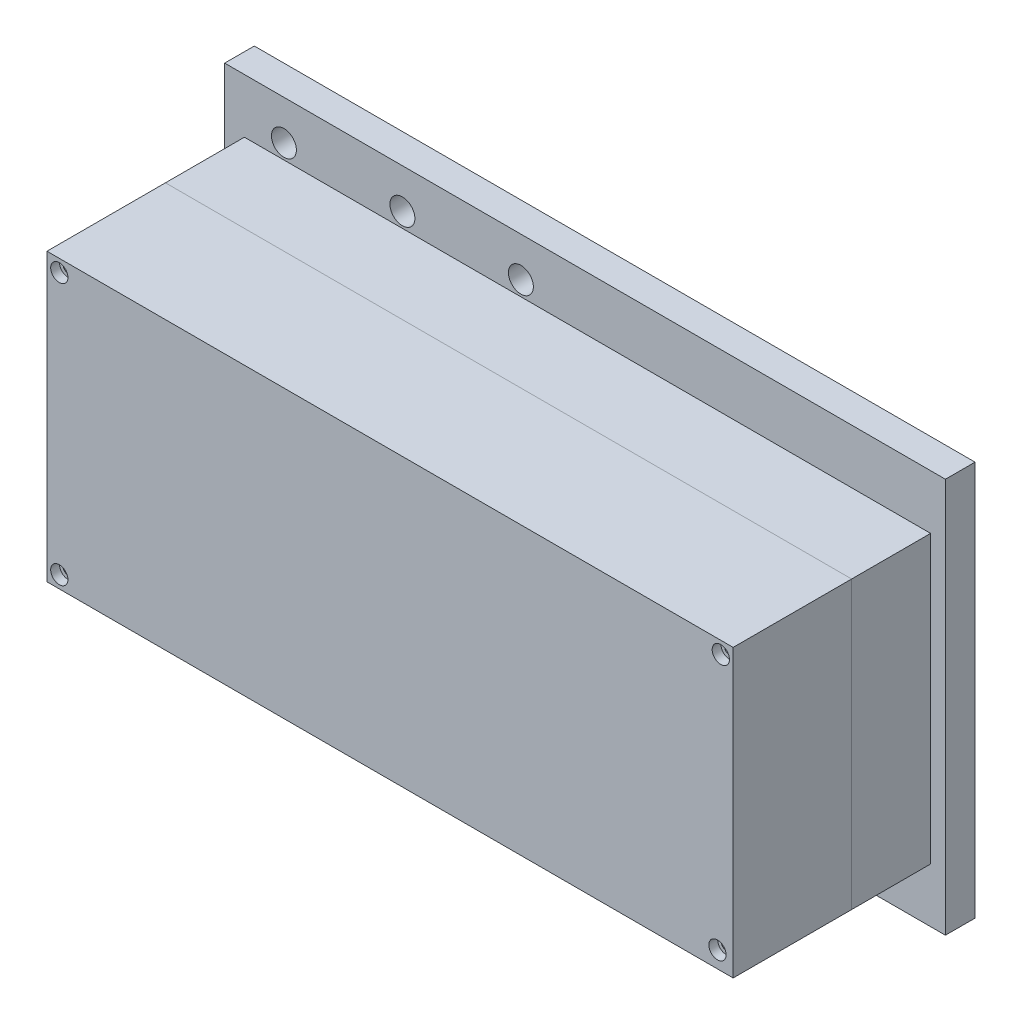
from build123d import *

# Parameters (mm, degrees)
SKETCH1_W                                     = 231.775
SKETCH1_H                                     = 127
BASE_DEPTH                                    = 9.525
O_0_316_DIAMETER_HOLE1_D                      = 8.0264
SKETCH4_W                                     = 220.6625
SKETCH4_H                                     = 92.075
SKETCH4_W_2                                   = 204.7875
SKETCH4_H_2                                   = 76.2
BOSS_EXTRUDE2_DEPTH                           = 25.4
F_23_0_154_DIAMETER_HOLE1_D                   = 3.9116
F_23_0_154_DIAMETER_HOLE1_CSINK_D             = 5.1816
F_23_0_154_DIAMETER_HOLE1_CSINK_ANGLE         = 90
F_23_0_154_DIAMETER_HOLE2_D                   = 3.9116
F_23_0_154_DIAMETER_HOLE2_DEPTH               = 12.7
F_23_0_154_DIAMETER_HOLE2_CSINK_D             = 5.1816
F_23_0_154_DIAMETER_HOLE2_CSINK_ANGLE         = 90
F_23_0_154_DIAMETER_HOLE2_TIP                 = 1.175163199
CUT_EXTRUDE1_REACH                            = 165.243
SKETCH11_W                                    = 192.0875
SKETCH11_H                                    = 12.7
CUT_EXTRUDE2_REACH                            = 238.788
SKETCH12_W                                    = 12.7
SKETCH12_H                                    = 63.5
BOSS_EXTRUDE3_DEPTH                           = 31.75
BOSS_EXTRUDE3_2_DEPTH                         = 31.75
SKETCH14_W                                    = 220.6625
SKETCH14_H                                    = 92.075
BOSS_EXTRUDE4_DEPTH                           = 6.35
CBORE_FOR_4_SOCKET_HEAD_CAP_SCREW1_AT_2_COUNT = 2
CBORE_FOR_4_SOCKET_HEAD_CAP_SCREW1_AT_2_PITCH = 84.1375
CBORE_FOR_4_SOCKET_HEAD_CAP_SCREW1_AT_3_COUNT = 2
CBORE_FOR_4_SOCKET_HEAD_CAP_SCREW1_AT_3_PITCH = 228.75979658
CBORE_FOR_4_SOCKET_HEAD_CAP_SCREW1_AT_4_COUNT = 2
CBORE_FOR_4_SOCKET_HEAD_CAP_SCREW1_AT_4_PITCH = 211.660894197
FILLET1_R                                     = 2.54


with BuildPart() as part:
    # Sketch1 → base (new body)
    with BuildSketch(Plane.XY):
        Rectangle(SKETCH1_W, SKETCH1_H)
    extrude(amount=BASE_DEPTH)

    # O (0.316) Diameter Hole1 (through all)
    with Locations(Plane.XY.offset(9.525)):
        with Locations((-96.8375, 50.8), (-58.7375, 50.8), (-20.6375, 50.8), (-20.6375, 25.4), (-58.7375, 25.4), (-96.8375, 25.4), (-96.8375, -25.4), (-96.8375, -50.8), (-58.7375, -50.8), (-58.7375, -25.4), (-20.6375, -25.4), (-20.6375, -50.8)):
            Hole(O_0_316_DIAMETER_HOLE1_D / 2)

    # Sketch4 → Boss-Extrude2 (add)
    with BuildSketch(Plane.XY.offset(9.525)):
        with Locations((0.79375, 0)):
            Rectangle(SKETCH4_W, SKETCH4_H)
        with Locations((0.79375, 0)):
            Rectangle(SKETCH4_W_2, SKETCH4_H_2, mode=Mode.SUBTRACT)
    extrude(amount=BOSS_EXTRUDE2_DEPTH)

    # #23 (0.154) Diameter Hole1 (through all)
    with Locations(Plane.XY.offset(9.525)):
        with Locations((74.83475, 22.733), (74.83475, -22.733), (-85.94725, 21.717), (49.43475, 21.717), (49.43475, -21.717), (-85.94725, -21.717)):
            CounterSinkHole(F_23_0_154_DIAMETER_HOLE1_D / 2, F_23_0_154_DIAMETER_HOLE1_CSINK_D / 2, counter_sink_angle=F_23_0_154_DIAMETER_HOLE1_CSINK_ANGLE)

    # #23 (0.154) Diameter Hole2
    with Locations(Plane.XY.offset(34.925)):
        with Locations((-105.56875, 42.06875), (-105.56875, -42.06875), (106.087893927, -40.727402306), (107.15625, 42.06875)):
            CounterSinkHole(F_23_0_154_DIAMETER_HOLE2_D / 2, F_23_0_154_DIAMETER_HOLE2_CSINK_D / 2, depth=F_23_0_154_DIAMETER_HOLE2_DEPTH, counter_sink_angle=F_23_0_154_DIAMETER_HOLE2_CSINK_ANGLE)
            with Locations((0, 0, -(F_23_0_154_DIAMETER_HOLE2_DEPTH + F_23_0_154_DIAMETER_HOLE2_TIP / 2))):  # 118° drill point
                Cone(0, F_23_0_154_DIAMETER_HOLE2_D / 2, F_23_0_154_DIAMETER_HOLE2_TIP, mode=Mode.SUBTRACT)

    # Sketch11 → Cut-Extrude1 (cut, up to next)
    with BuildSketch(Plane.XZ.offset(46.0375), mode=Mode.PRIVATE) as cut_extrude1_sk1:
        with Locations((0.79375, 28.575)):
            Rectangle(SKETCH11_W, SKETCH11_H)
    cut_extrude1_tool1 = extrude(cut_extrude1_sk1.sketch, amount=-CUT_EXTRUDE1_REACH, mode=Mode.PRIVATE) & part.part
    add(cut_extrude1_tool1.solids().sort_by_distance((0.79375, -46.0375, 28.575))[0], mode=Mode.SUBTRACT)

    # Sketch12 → Cut-Extrude2 (cut, up to next)
    with BuildSketch(Plane.ZY.offset(109.5375), mode=Mode.PRIVATE) as cut_extrude2_sk1:
        with Locations((28.575, 0)):
            Rectangle(SKETCH12_W, SKETCH12_H)
    cut_extrude2_tool1 = extrude(cut_extrude2_sk1.sketch, amount=-CUT_EXTRUDE2_REACH, mode=Mode.PRIVATE) & part.part
    add(cut_extrude2_tool1.solids().sort_by_distance((-109.5375, 0, 28.575))[0], mode=Mode.SUBTRACT)


with BuildPart() as body_2:
    # Sketch13 → Boss-Extrude3 (new body)
    with BuildSketch(Plane.XY.offset(66.675)):
        Polygon((-101.6, 31.75), (-109.5375, 31.75), (-109.5375, 46.0375), (111.125, 46.0375), (111.125, -46.0375), (96.8375, -46.0375), (96.8375, -38.1), (103.1875, -38.1), (103.1875, 38.1), (-101.6, 38.1), align=None)
    extrude(amount=-BOSS_EXTRUDE3_DEPTH)



with BuildPart() as body_3:
    # Sketch13 → Boss-Extrude3 2 (new body)
    with BuildSketch(Plane.XY.offset(66.675)):
        Polygon((-101.6, -31.75), (-109.5375, -31.75), (-109.5375, -46.0375), (-95.25, -46.0375), (-95.25, -38.1), (-101.6, -38.1), align=None)
    extrude(amount=-BOSS_EXTRUDE3_2_DEPTH)


with BuildPart() as body_2_1:
    add(body_2.part)

    add(body_3.part)  # Boss-Extrude4 merges body 3
    # Sketch14 → Boss-Extrude4 (add)
    with BuildSketch(Plane.XY.offset(66.675)):
        with Locations((0.79375, 0)):
            Rectangle(SKETCH14_W, SKETCH14_H)
    extrude(amount=BOSS_EXTRUDE4_DEPTH)

    # Sketch16 → CBORE for #4 Socket Head Cap Screw1 (revolve, cut)
    with BuildSketch(Plane(origin=(-105.56875, -42.06875, 73.025), x_dir=(0, -1, 0), z_dir=(1, 0, 0))):
        Polygon((0, 0), (0, 73.025), (1.63195, 73.025), (1.63195, 2.8448), (2.77876, 2.8448), (2.77876, 0), align=None)
    cbore_for_4_socket_head_cap_screw1 = revolve(axis=Axis((-105.56875, -42.06875, 79.375), (0, 0, -1)), mode=Mode.SUBTRACT)

    # CBORE for #4 Socket Head Cap Screw1 at 2: CBORE for #4 Socket Head Cap Screw1 ×2
    with Locations(*[(0, i * CBORE_FOR_4_SOCKET_HEAD_CAP_SCREW1_AT_2_PITCH, 0) for i in range(1, CBORE_FOR_4_SOCKET_HEAD_CAP_SCREW1_AT_2_COUNT)]):
        add(cbore_for_4_socket_head_cap_screw1, mode=Mode.SUBTRACT)

    # CBORE for #4 Socket Head Cap Screw1 at 3: CBORE for #4 Socket Head Cap Screw1 ×2
    with Locations(*[Vector(0.9299055305190211, 0.36779845610080775, 0) * (i * CBORE_FOR_4_SOCKET_HEAD_CAP_SCREW1_AT_3_PITCH) for i in range(1, CBORE_FOR_4_SOCKET_HEAD_CAP_SCREW1_AT_3_COUNT)]):
        add(cbore_for_4_socket_head_cap_screw1, mode=Mode.SUBTRACT)

    # CBORE for #4 Socket Head Cap Screw1 at 4: CBORE for #4 Socket Head Cap Screw1 ×2
    with Locations(*[Vector(0.9999799194388271, 0.006337248544668003, 0) * (i * CBORE_FOR_4_SOCKET_HEAD_CAP_SCREW1_AT_4_PITCH) for i in range(1, CBORE_FOR_4_SOCKET_HEAD_CAP_SCREW1_AT_4_COUNT)]):
        add(cbore_for_4_socket_head_cap_screw1, mode=Mode.SUBTRACT)

    # Fillet1
    fillet1_edges = [body_2_1.edges().sort_by_distance(p)[0] for p in [
        (96.8375, -42.06875, 66.675),
        (100.0125, -38.1, 66.675),
        (103.1875, 0, 66.675),
        (0.79375, 38.1, 66.675),
        (-101.6, 34.925, 66.675),
        (-101.6, 38.1, 50.8),
        (103.1875, 38.1, 50.8),
        (96.8375, -46.0375, 50.8),
        (-109.5375, 31.75, 50.8),
        (-109.5375, 0, 66.675),
        (0.79375, -46.0375, 66.675),
        (-95.25, -46.0375, 50.8),
        (-109.5375, -31.75, 50.8),
        (-101.6, -34.925, 66.675),
        (-105.56875, -31.75, 66.675),
        (-95.25, -42.06875, 66.675),
        (-98.425, -38.1, 66.675),
        (-105.56875, 31.75, 66.675),
    ]]
    fillet(fillet1_edges, radius=FILLET1_R)


solid = Compound([part.part, body_2_1.part])
